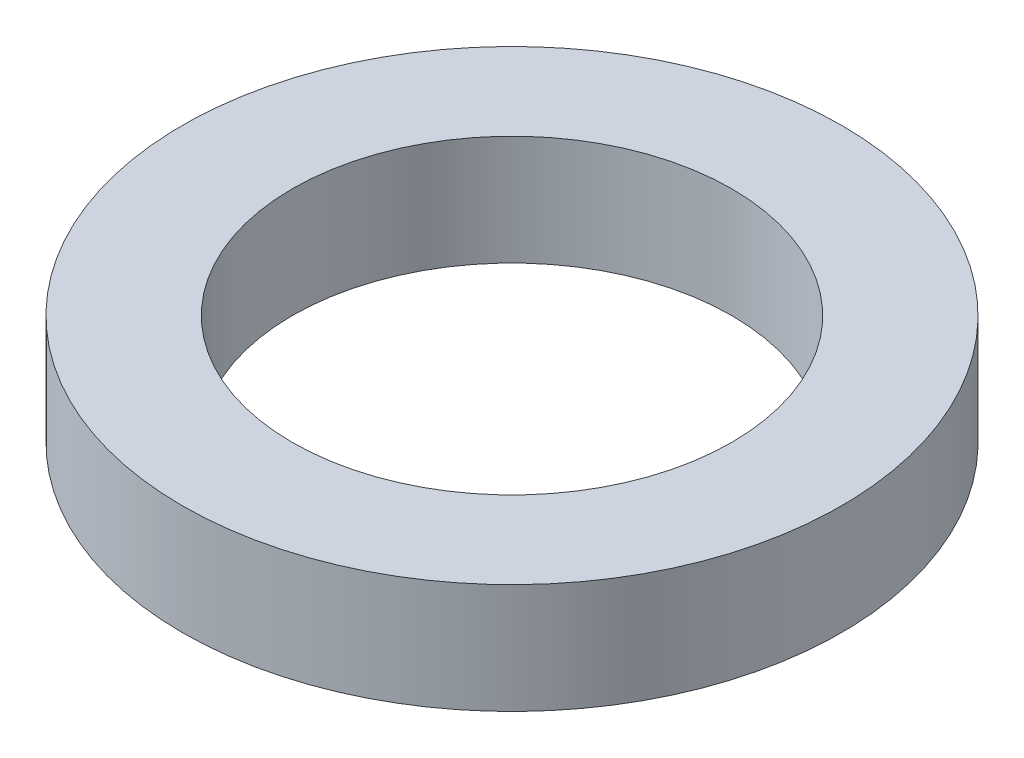
from build123d import *

# Parameters (mm, degrees)
SKETCH1_W = 1.5875
SKETCH1_H = 1.5875


with BuildPart() as part:
    # Sketch1 → Revolve1 (revolve)
    with BuildSketch(Plane.XY, mode=Mode.PRIVATE) as revolve1_sk:
        with Locations((3.96875, 0.79375)):
            Rectangle(SKETCH1_W, SKETCH1_H)
    revolve(revolve1_sk.sketch.rotate(Axis((0, 1.5875, 0), (0, -1, 0)), 270), axis=Axis((0, 1.5875, 0), (0, -1, 0)))


solid = part.part
